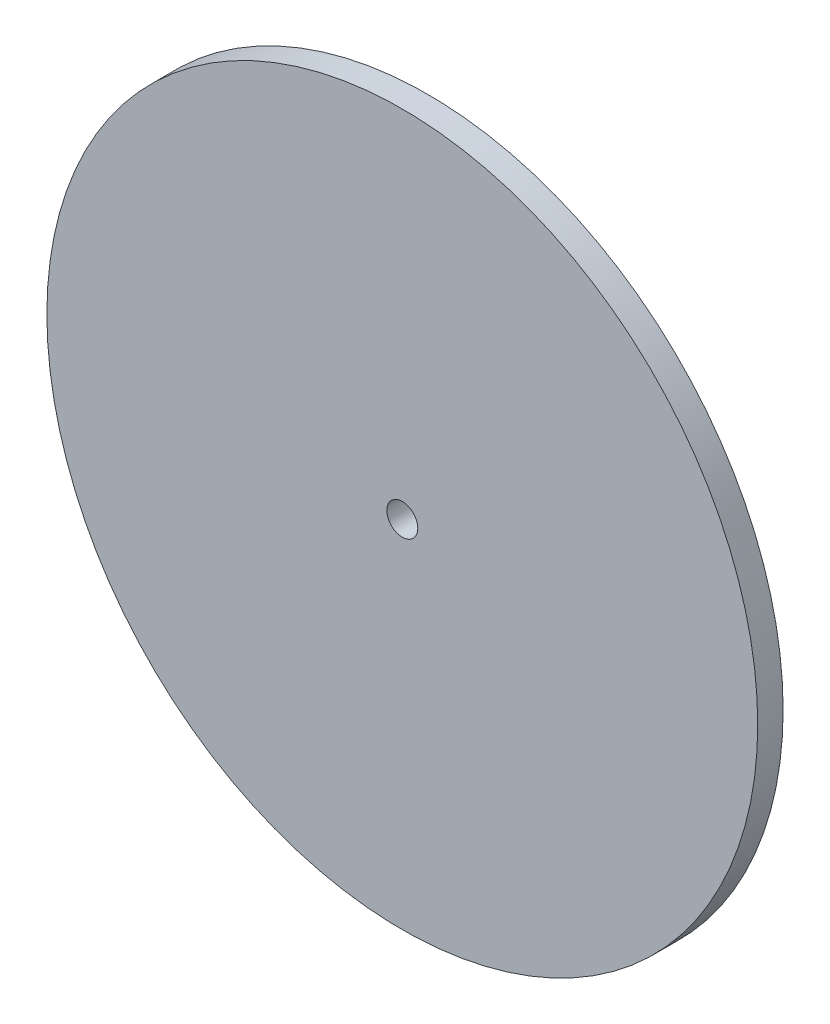
from build123d import *

# Parameters (mm, degrees)
SKETCH1_R           = 70
SKETCH1_R_2         = 3.05
BOSS_EXTRUDE1_DEPTH = 5


with BuildPart() as part:
    # Sketch1 → Boss-Extrude1 (new body)
    with BuildSketch(Plane.XY):
        Circle(SKETCH1_R)
        Circle(SKETCH1_R_2, mode=Mode.SUBTRACT)
    extrude(amount=BOSS_EXTRUDE1_DEPTH)


solid = part.part
